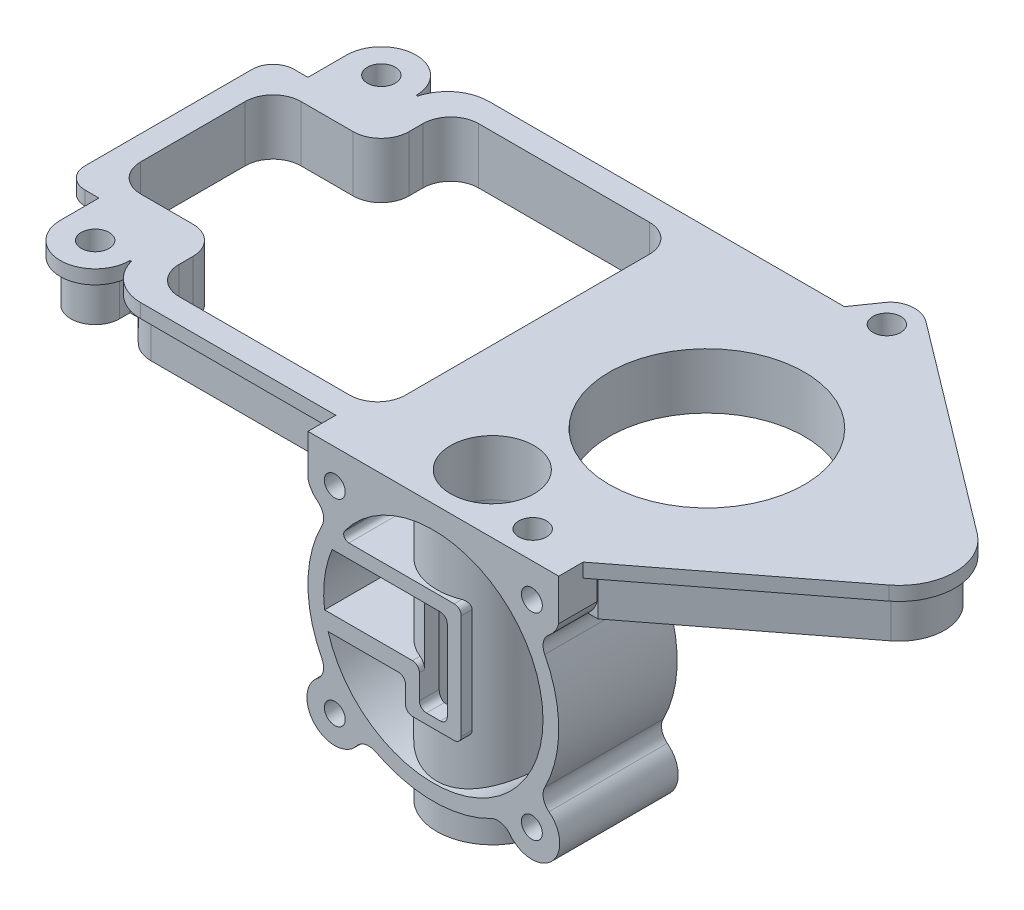
from build123d import *

# Parameters (mm, degrees)
DODANIE_WYCI_GNI_CIE1_DEPTH     = 17
SZKIC1_4_OUTSIDE_W              = 49.212
SZKIC1_4_OUTSIDE_H              = 50.07
SZKIC1_4_OUTSIDE_R              = 1.5
WYTNIJ_WYCI_GNI_CIE2_DEPTH      = 17
SZKIC4_R                        = 8
DODANIE_WYCI_GNI_CIE2_DEPTH     = 41
WYTNIJ_WYCI_GNI_CIE4_DEPTH      = 3
WYTNIJ_WYCI_GNI_CIE4_DEPTH_BACK = 40.7
SZKIC4_4_R                      = 6
WYTNIJ_WYCI_GNI_CIE5_DEPTH      = 6
DODANIE_WYCI_GNI_CIE6_DEPTH     = 2
DODANIE_WYCI_GNI_CIE7_DEPTH     = 6
SZKIC10_R                       = 14
SZKIC10_R_2                     = 2
SZKIC10_R_3                     = 6
WYTNIJ_WYCI_GNI_CIE11_DEPTH     = 8


with BuildPart() as part:
    # Szkic1 → Dodanie-wyciągnięcie1 (new body)
    with BuildSketch(Plane.XY):
        with BuildLine():
            Line((18, 19), (-18, 19))
            Line((-18, 19), (-18, 13.085309028))
            ThreePointArc((-18, 13.085309028), (-17.466956761, 11.918273127), (-16.591850129, 10.980032076))
            ThreePointArc((-16.591850129, 10.980032076), (-15.800133333, 9.729832187), (-15.991609998, 8.26246995))
            ThreePointArc((-15.991609998, 8.26246995), (-18, 0), (-15.991609998, -8.26246995))
            ThreePointArc((-15.991609998, -8.26246995), (-15.800133333, -9.729832187), (-16.591850129, -10.980032076))
            ThreePointArc((-16.591850129, -10.980032076), (-16.970562748, -16.970562748), (-10.980032076, -16.591850129))
            ThreePointArc((-10.980032076, -16.591850129), (-9.729832187, -15.800133333), (-8.26246995, -15.991609998))
            ThreePointArc((-8.26246995, -15.991609998), (0, -18), (8.26246995, -15.991609998))
            ThreePointArc((8.26246995, -15.991609998), (9.729832187, -15.800133333), (10.980032076, -16.591850129))
            ThreePointArc((10.980032076, -16.591850129), (16.970562748, -16.970562748), (16.591850129, -10.980032076))
            ThreePointArc((16.591850129, -10.980032076), (15.800133333, -9.729832187), (15.991609998, -8.26246995))
            ThreePointArc((15.991609998, -8.26246995), (18, 0), (15.991609998, 8.26246995))
            ThreePointArc((15.991609998, 8.26246995), (15.800133333, 9.729832187), (16.591850129, 10.980032076))
            ThreePointArc((16.591850129, 10.980032076), (17.466956761, 11.918273127), (18, 13.085309028))
            Line((18, 13.085309028), (18, 19))
        make_face()
    extrude(amount=-DODANIE_WYCI_GNI_CIE1_DEPTH)

    # Szkic1<4> outside → Wytnij-wyciągnięcie2 (cut)
    # profile 1 of 7: a face of its own
    with BuildSketch(Plane.XY):
        with Locations((0, 0.429)):
            Rectangle(SZKIC1_4_OUTSIDE_W, SZKIC1_4_OUTSIDE_H)
        with BuildLine():
            Line((18, 19), (-18, 19))
            Line((-18, 19), (-18, 13.085309028))
            ThreePointArc((-18, 13.085309028), (-17.466956761, 11.918273127), (-16.591850129, 10.980032076))
            ThreePointArc((-16.591850129, 10.980032076), (-15.800133333, 9.729832187), (-15.991609998, 8.26246995))
            ThreePointArc((-15.991609998, 8.26246995), (-18, 0), (-15.991609998, -8.26246995))
            ThreePointArc((-15.991609998, -8.26246995), (-15.800133333, -9.729832187), (-16.591850129, -10.980032076))
            ThreePointArc((-16.591850129, -10.980032076), (-16.970562748, -16.970562748), (-10.980032076, -16.591850129))
            ThreePointArc((-10.980032076, -16.591850129), (-9.729832187, -15.800133333), (-8.26246995, -15.991609998))
            ThreePointArc((-8.26246995, -15.991609998), (0, -18), (8.26246995, -15.991609998))
            ThreePointArc((8.26246995, -15.991609998), (9.729832187, -15.800133333), (10.980032076, -16.591850129))
            ThreePointArc((10.980032076, -16.591850129), (16.970562748, -16.970562748), (16.591850129, -10.980032076))
            ThreePointArc((16.591850129, -10.980032076), (15.800133333, -9.729832187), (15.991609998, -8.26246995))
            ThreePointArc((15.991609998, -8.26246995), (18, 0), (15.991609998, 8.26246995))
            ThreePointArc((15.991609998, 8.26246995), (15.800133333, 9.729832187), (16.591850129, 10.980032076))
            ThreePointArc((16.591850129, 10.980032076), (17.466956761, 11.918273127), (18, 13.085309028))
            Line((18, 13.085309028), (18, 19))
        make_face(mode=Mode.SUBTRACT)
    # profile 2 of 7: a face of its own
    with BuildSketch(Plane.XY):
        with Locations((14.142135624, -14.142135624)):
            Circle(SZKIC1_4_OUTSIDE_R)
    # profile 3 of 7: a face of its own
    with BuildSketch(Plane.XY):
        with Locations((-14.142135624, -14.142135624)):
            Circle(SZKIC1_4_OUTSIDE_R)
    # profile 4 of 7: a face of its own
    with BuildSketch(Plane.XY):
        with Locations((-14.142135624, 14.142135624)):
            Circle(SZKIC1_4_OUTSIDE_R)
    # profile 5 of 7: a face of its own
    with BuildSketch(Plane.XY):
        with Locations((14.142135624, 14.142135624)):
            Circle(SZKIC1_4_OUTSIDE_R)
    # profile 6 of 7: a face of its own
    with BuildSketch(Plane.XY):
        with BuildLine():
            Line((-15.612074363, -2), (-3, -2))
            ThreePointArc((-3, -2), (-2.292893219, -2.292893219), (-2, -3))
            Line((-2, -3), (-2, -6.5))
            ThreePointArc((-2, -6.5), (-1.707106781, -7.207106781), (-1, -7.5))
            Line((-1, -7.5), (1, -7.5))
            ThreePointArc((1, -7.5), (1.707106781, -7.207106781), (2, -6.5))
            Line((2, -6.5), (2, 5.064186144))
            ThreePointArc((2, 5.064186144), (1.707106781, 5.771292925), (1, 6.064186144))
            Line((1, 6.064186144), (-14.52454861, 6.064186144))
            ThreePointArc((-14.52454861, 6.064186144), (-15.59845459, 2.103587488), (-15.612074363, -2))
        make_face()
    # profile 7 of 7: a face of its own
    with BuildSketch(Plane.XY):
        with BuildLine():
            Line((4, 7.064186144), (4, -7.935813856))
            ThreePointArc((4, -7.935813856), (3.707106781, -8.642920637), (3, -8.935813856))
            Line((3, -8.935813856), (-3, -8.935813856))
            ThreePointArc((-3, -8.935813856), (-3.707106781, -8.642920637), (-4, -7.935813856))
            Line((-4, -7.935813856), (-4, -5.435813856))
            ThreePointArc((-4, -5.435813856), (-4.292893219, -4.728707075), (-5, -4.435813856))
            Line((-5, -4.435813856), (-15.101669488, -4.435813856))
            ThreePointArc((-15.101669488, -4.435813856), (15.508875462, -2.685451138), (-12.73099165, 9.255199485))
            ThreePointArc((-12.73099165, 9.255199485), (-12.792659478, 8.473789321), (-12.124355653, 8.064186144))
            Line((-12.124355653, 8.064186144), (3, 8.064186144))
            ThreePointArc((3, 8.064186144), (3.707106781, 7.771292925), (4, 7.064186144))
        make_face()
    extrude(amount=-WYTNIJ_WYCI_GNI_CIE2_DEPTH, mode=Mode.SUBTRACT)

    # Szkic4 → Dodanie-wyciągnięcie2 (add)
    with BuildSketch(Plane(origin=(0, 19, 0), x_dir=(1, 0, 0), z_dir=(0, 1, 0))):
        with Locations((0, 8.5)):
            Circle(SZKIC4_R)
    extrude(amount=-DODANIE_WYCI_GNI_CIE2_DEPTH)

    # Szkic4<4> → Wytnij-wyciągnięcie4 (cut, two sides: drawn at the far end of the back side and taken through both)
    with BuildSketch(Plane(origin=(0, 19, 0), x_dir=(1, 0, 0), z_dir=(0, 1, 0)).offset(-WYTNIJ_WYCI_GNI_CIE4_DEPTH_BACK)):
        with Locations((0, 8.5)):
            Circle(SZKIC4_4_R)
    extrude(amount=WYTNIJ_WYCI_GNI_CIE4_DEPTH + WYTNIJ_WYCI_GNI_CIE4_DEPTH_BACK, mode=Mode.SUBTRACT)

    # Szkic6 → Wytnij-wyciągnięcie5 (cut)
    with BuildSketch(Plane.XY):
        with BuildLine():
            Line((2, 5.064186144), (2, -6.5))
            ThreePointArc((2, -6.5), (1.707106781, -7.207106781), (1, -7.5))
            Line((1, -7.5), (-1, -7.5))
            ThreePointArc((-1, -7.5), (-1.707106781, -7.207106781), (-2, -6.5))
            Line((-2, -6.5), (-2, 5.064186144))
            ThreePointArc((-2, 5.064186144), (-1.707106781, 5.771292925), (-1, 6.064186144))
            Line((-1, 6.064186144), (1, 6.064186144))
            ThreePointArc((1, 6.064186144), (1.707106781, 5.771292925), (2, 5.064186144))
        make_face()
    extrude(amount=-WYTNIJ_WYCI_GNI_CIE5_DEPTH, mode=Mode.SUBTRACT)

    # Szkic7 → Dodanie-wyciągnięcie6 (add)
    with BuildSketch(Plane(origin=(0, 19, 0), x_dir=(1, 0, 0), z_dir=(0, 1, 0))):
        with BuildLine():
            Line((-18, 0), (18, 0))
            Line((18, 0), (18, 3.5))
            Line((18, 3.5), (42.805678794, 22.598091155))
            ThreePointArc((42.805678794, 22.598091155), (45.925204865, 28.975197341), (42.74493694, 35.322229888))
            Line((42.74493694, 35.322229888), (18, 54))
            Line((18, 54), (12.669054996, 58.023860134))
            ThreePointArc((12.669054996, 58.023860134), (10.915703688, 58.777012409), (9.012944958, 58.63213875))
            Line((9.012944958, 58.63213875), (8.952256968, 58.612239512))
            ThreePointArc((8.952256968, 58.612239512), (8.09721687, 58.169220255), (7.426593288, 57.478117047))
            Line((7.426593288, 57.478117047), (5, 54))
            Line((5, 54), (-46, 54))
            ThreePointArc((-46, 54), (-49.659414236, 52.754859351), (-51.8, 49.53622915))
            Line((-51.8, 49.53622915), (-52, 49.53622915))
            ThreePointArc((-52, 49.53622915), (-53.464466094, 53.071763056), (-57, 54.53622915))
            ThreePointArc((-57, 54.53622915), (-60.535533906, 53.071763056), (-62, 49.53622915))
            Line((-62, 49.53622915), (-62, 44))
            Line((-62, 44), (-64, 44))
            ThreePointArc((-64, 44), (-66.121320344, 43.121320344), (-67, 41))
            Line((-67, 41), (-67, 17))
            ThreePointArc((-67, 17), (-66.121320344, 14.878679657), (-64, 14))
            Line((-64, 14), (-62, 14))
            Line((-62, 14), (-62, 8.46377085))
            ThreePointArc((-62, 8.46377085), (-60.535533906, 4.928236944), (-57, 3.46377085))
            ThreePointArc((-57, 3.46377085), (-53.464466094, 4.928236944), (-52, 8.46377085))
            Line((-52, 8.46377085), (-51.8, 8.46377085))
            ThreePointArc((-51.8, 8.46377085), (-49.659414236, 5.245140649), (-46, 4))
            Line((-46, 4), (-18, 4))
            Line((-18, 4), (-18, 0))
        make_face()
    extrude(amount=-DODANIE_WYCI_GNI_CIE6_DEPTH)

    # Szkic9 → Dodanie-wyciągnięcie7 (add)
    with BuildSketch(Plane(origin=(0, 17, 0), x_dir=(-1, 0, 0), z_dir=(0, -1, 0))):
        with BuildLine():
            Line((53.5, 8.46377085), (53.5, 9.96377085))
            Line((53.5, 9.96377085), (50.35, 9.96377085))
            Line((50.35, 9.96377085), (50.35, 8.847828138))
            ThreePointArc((50.35, 8.847828138), (48.744560677, 6.433855487), (46, 5.5))
            Line((46, 5.5), (-18.138889362, 5.5))
            Line((-18.138889362, 5.5), (-41.890607023, 23.786638022))
            ThreePointArc((-41.890607023, 23.786638022), (-44.425221956, 28.968036798), (-41.841254267, 34.125000743))
            Line((-41.841254267, 34.125000743), (-11.765372323, 56.826630988))
            ThreePointArc((-11.765372323, 56.826630988), (-10.651765694, 57.300240632), (-9.446185823, 57.19534548))
            ThreePointArc((-9.446185823, 57.19534548), (-9.003321049, 56.973660207), (-8.65678372, 56.619844653))
            Line((-8.65678372, 56.619844653), (-5.782473497, 52.5))
            Line((-5.782473497, 52.5), (46, 52.5))
            ThreePointArc((46, 52.5), (48.744560677, 51.566144513), (50.35, 49.152171862))
            Line((50.35, 49.152171862), (50.35, 48.03622915))
            Line((50.35, 48.03622915), (53.5, 48.03622915))
            Line((53.5, 48.03622915), (53.5, 49.53622915))
            ThreePointArc((53.5, 49.53622915), (57, 53.03622915), (60.5, 49.53622915))
            Line((60.5, 49.53622915), (60.5, 42.5))
            Line((60.5, 42.5), (64, 42.5))
            ThreePointArc((64, 42.5), (65.060660172, 42.060660172), (65.5, 41))
            Line((65.5, 41), (65.5, 17))
            ThreePointArc((65.5, 17), (65.060660172, 15.939339828), (64, 15.5))
            Line((64, 15.5), (60.5, 15.5))
            Line((60.5, 15.5), (60.5, 8.46377085))
            ThreePointArc((60.5, 8.46377085), (57, 4.96377085), (53.5, 8.46377085))
        make_face()
    extrude(amount=DODANIE_WYCI_GNI_CIE7_DEPTH)

    # Szkic10 → Wytnij-wyciągnięcie11 (cut)
    with BuildSketch(Plane(origin=(0, 19, 0), x_dir=(1, 0, 0), z_dir=(0, 1, 0))):
        with Locations((10.259234535, 29)):
            Circle(SZKIC10_R)
        with Locations((10.259234535, 54.831249079)):
            Circle(SZKIC10_R_2)
        with Locations((-57, 8.46377085)):
            Circle(SZKIC10_R_2)
        with Locations((-57, 49.53622915)):
            Circle(SZKIC10_R_2)
        with Locations((10.259234535, 4)):
            Circle(SZKIC10_R_2)
        with Locations((0, 8.46377085)):
            Circle(SZKIC10_R_3)
        with BuildLine():
            Line((-59.5, 40.5), (-52, 40.5))
            ThreePointArc((-52, 40.5), (-49.171572875, 41.671572875), (-48, 44.5))
            Line((-48, 44.5), (-48, 46.5))
            ThreePointArc((-48, 46.5), (-46.828427125, 49.328427125), (-44, 50.5))
            Line((-44, 50.5), (-19.5, 50.5))
            ThreePointArc((-19.5, 50.5), (-16.671572875, 49.328427125), (-15.5, 46.5))
            Line((-15.5, 46.5), (-15.5, 11.5))
            ThreePointArc((-15.5, 11.5), (-16.671572875, 8.671572875), (-19.5, 7.5))
            Line((-19.5, 7.5), (-44, 7.5))
            ThreePointArc((-44, 7.5), (-46.828427125, 8.671572875), (-48, 11.5))
            Line((-48, 11.5), (-48, 13.5))
            ThreePointArc((-48, 13.5), (-49.171572875, 16.328427125), (-52, 17.5))
            Line((-52, 17.5), (-59.5, 17.5))
            ThreePointArc((-59.5, 17.5), (-62.328427125, 18.671572875), (-63.5, 21.5))
            Line((-63.5, 21.5), (-63.5, 36.5))
            ThreePointArc((-63.5, 36.5), (-62.328427125, 39.328427125), (-59.5, 40.5))
        make_face()
    extrude(amount=-WYTNIJ_WYCI_GNI_CIE11_DEPTH, mode=Mode.SUBTRACT)


solid = part.part
